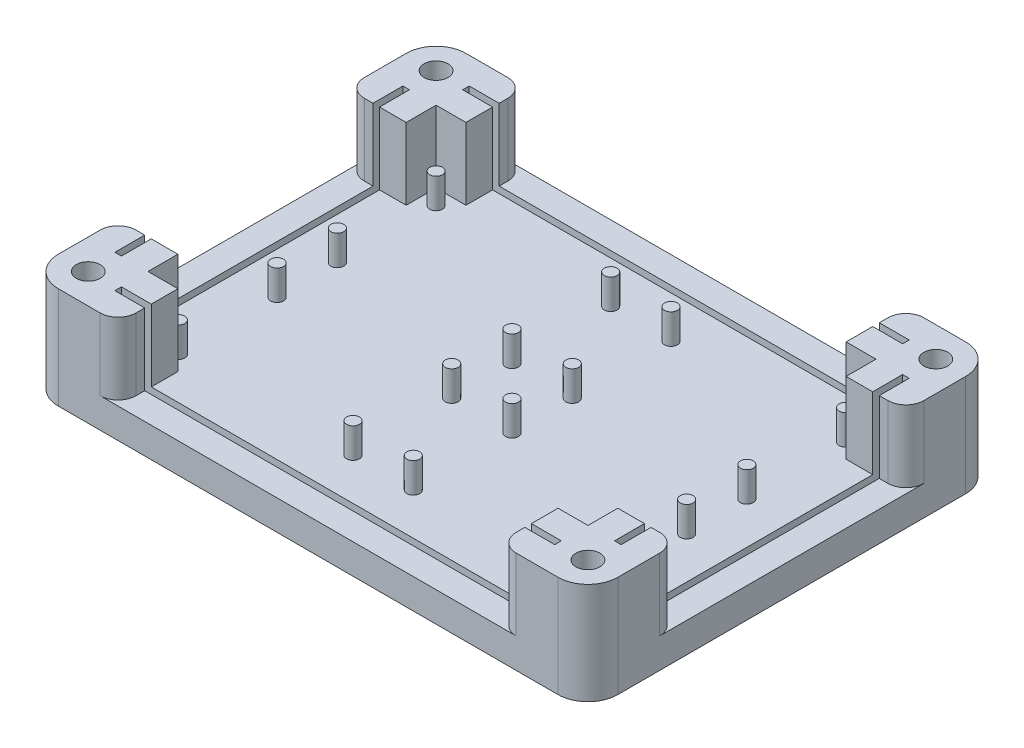
from build123d import *

# Parameters (mm, degrees)
SKETCH1_W                 = 93.58
SKETCH1_H                 = 68.18
BASE_DEPTH                = 5
SKETCH2_W                 = 93.58
SKETCH2_H                 = 68.18
WALLS_DEPTH               = 12
SKETCH2_4_R               = 1.07
SCREW_HOLES_DEPTH         = 5
SKETCH4_W                 = 4.45
SKETCH4_H                 = 38.18
SKETCH4_W_2               = 1.1
SKETCH4_W_3               = 63.58
SKETCH4_H_2               = 4.45
SKETCH4_H_3               = 1.1
WALLS_CUT_DEPTH           = 12
SKETCH4_3_W               = 5
SKETCH4_3_H               = 1.1
SKETCH4_3_W_2             = 1.1
SKETCH4_3_H_2             = 5
SKETCH4_3_W_3             = 63.58
SKETCH4_3_H_3             = 38.18
ACRYLIC_CUT_DEPTH         = 14
FILLET2_R                 = 5
FILLET3_R                 = 3
SKETCH5_W                 = 34
SKETCH5_H                 = 34
ARM_ATTACH_BODY_CUT_DEPTH = 1.5
SKETCH6_R                 = 2
CUT_EXTRUDE1_DEPTH        = 61.335994232


with BuildPart() as part:
    # Sketch1 → Base (new body)
    with BuildSketch(Plane(origin=(0, 0, 0), x_dir=(1, 0, 0), z_dir=(0, 1, 0))):
        Rectangle(SKETCH1_W, SKETCH1_H)
    extrude(amount=BASE_DEPTH)

    # Sketch2 → Walls (add)
    with BuildSketch(Plane(origin=(0, 5, 0), x_dir=(1, 0, 0), z_dir=(0, 1, 0))):
        Rectangle(SKETCH2_W, SKETCH2_H)
        Polygon((36.79, -2), (36.79, -24.09), (2, -24.09), (-2, -24.09), (-36.79, -24.09), (-36.79, -2), (-36.79, 2), (-36.79, 24.09), (-2, 24.09), (2, 24.09), (36.79, 24.09), (36.79, 2), align=None, mode=Mode.SUBTRACT)
    extrude(amount=WALLS_DEPTH)

    # Sketch2<4> → Screw Holes (add)
    with BuildSketch(Plane(origin=(0, 5, 0), x_dir=(1, 0, 0), z_dir=(0, 1, 0))):
        with Locations(Location((-5.04, 5.04, 0), (0, 0, 270))):
            Circle(SKETCH2_4_R)
        with Locations(Location((-34.25, 5.04, 0), (0, 0, 270))):
            Circle(SKETCH2_4_R)
        with Locations(Location((-34.25, 21.55, 0), (0, 0, 270))):
            Circle(SKETCH2_4_R)
        with Locations(Location((5.04, 21.55, 0), (0, 0, 90))):
            Circle(SKETCH2_4_R)
        with Locations(Location((5.04, 5.04, 0), (0, 0, 90))):
            Circle(SKETCH2_4_R)
        with Locations(Location((34.25, 5.04, 0), (0, 0, 90))):
            Circle(SKETCH2_4_R)
        with Locations(Location((34.25, 21.55, 0), (0, 0, 90))):
            Circle(SKETCH2_4_R)
        with Locations(Location((34.25, -5.04, 0), (0, 0, 270))):
            Circle(SKETCH2_4_R)
        with Locations(Location((34.25, -21.55, 0), (0, 0, 270))):
            Circle(SKETCH2_4_R)
        with Locations(Location((5.04, -21.55, 0), (0, 0, 270))):
            Circle(SKETCH2_4_R)
        with Locations(Location((5.04, -5.04, 0), (0, 0, 270))):
            Circle(SKETCH2_4_R)
        with Locations(Location((-5.04, -5.04, 0), (0, 0, 90))):
            Circle(SKETCH2_4_R)
        with Locations(Location((-34.25, -5.04, 0), (0, 0, 90))):
            Circle(SKETCH2_4_R)
        with Locations(Location((-34.25, -21.55, 0), (0, 0, 90))):
            Circle(SKETCH2_4_R)
        with Locations(Location((-5.04, -21.55, 0), (0, 0, 90))):
            Circle(SKETCH2_4_R)
        with Locations(Location((-5.04, 21.55, 0), (0, 0, 90))):
            Circle(SKETCH2_4_R)
    extrude(amount=SCREW_HOLES_DEPTH)

    # Sketch4 → Walls Cut (cut)
    with BuildSketch(Plane(origin=(0, 17, 0), x_dir=(1, 0, 0), z_dir=(0, 1, 0))):
        with Locations((39.015, 0)):
            Rectangle(SKETCH4_W, SKETCH4_H)
        with Locations((44.565, 0)):
            Rectangle(SKETCH4_W, SKETCH4_H)
        with Locations((41.79, 0)):
            Rectangle(SKETCH4_W_2, SKETCH4_H)
        with Locations((0, -26.315)):
            Rectangle(SKETCH4_W_3, SKETCH4_H_2)
        with Locations((0, -31.865)):
            Rectangle(SKETCH4_W_3, SKETCH4_H_2)
        with Locations((0, -29.09)):
            Rectangle(SKETCH4_W_3, SKETCH4_H_3)
        with Locations((0, 26.315)):
            Rectangle(SKETCH4_W_3, SKETCH4_H_2)
        with Locations((0, 29.09)):
            Rectangle(SKETCH4_W_3, SKETCH4_H_3)
        with Locations((0, 31.865)):
            Rectangle(SKETCH4_W_3, SKETCH4_H_2)
        with Locations((-39.015, 0)):
            Rectangle(SKETCH4_W, SKETCH4_H)
        with Locations((-44.565, 0)):
            Rectangle(SKETCH4_W, SKETCH4_H)
        with Locations((-41.79, 0)):
            Rectangle(SKETCH4_W_2, SKETCH4_H)
    extrude(amount=-WALLS_CUT_DEPTH, mode=Mode.SUBTRACT)

    # Sketch4<3> → Acrylic Cut (cut)
    with BuildSketch(Plane(origin=(0, 17, 0), x_dir=(1, 0, 0), z_dir=(0, 1, 0))):
        with Locations((34.29, 29.09)):
            Rectangle(SKETCH4_3_W, SKETCH4_3_H)
        with Locations((-34.29, 29.09)):
            Rectangle(SKETCH4_3_W, SKETCH4_3_H)
        with Locations((-41.79, 21.59)):
            Rectangle(SKETCH4_3_W_2, SKETCH4_3_H_2)
        with Locations((-41.79, -21.59)):
            Rectangle(SKETCH4_3_W_2, SKETCH4_3_H_2)
        with Locations((-34.29, -29.09)):
            Rectangle(SKETCH4_3_W, SKETCH4_3_H)
        with Locations((41.79, -21.59)):
            Rectangle(SKETCH4_3_W_2, SKETCH4_3_H_2)
        with Locations((34.29, -29.09)):
            Rectangle(SKETCH4_3_W, SKETCH4_3_H)
        with Locations((41.79, 21.59)):
            Rectangle(SKETCH4_3_W_2, SKETCH4_3_H_2)
        with Locations((0, -29.09)):
            Rectangle(SKETCH4_3_W_3, SKETCH4_3_H)
        with Locations((-41.79, 0)):
            Rectangle(SKETCH4_3_W_2, SKETCH4_3_H_3)
        with Locations((0, 29.09)):
            Rectangle(SKETCH4_3_W_3, SKETCH4_3_H)
        with Locations((41.79, 0)):
            Rectangle(SKETCH4_3_W_2, SKETCH4_3_H_3)
    extrude(amount=-ACRYLIC_CUT_DEPTH, mode=Mode.SUBTRACT)

    # Fillet2
    fillet2_edges = [part.edges().sort_by_distance(p)[0] for p in [
        (-46.79, 8.5, 34.09),
        (46.79, 8.5, 34.09),
        (46.79, 8.5, -34.09),
        (-46.79, 8.5, -34.09),
    ]]
    fillet(fillet2_edges, radius=FILLET2_R)

    # Fillet3
    fillet3_edges = [part.edges().sort_by_distance(p)[0] for p in [
        (46.79, 11, -19.09),
        (46.79, 11, 19.09),
        (31.79, 11, 34.09),
        (-31.79, 11, 34.09),
        (-31.79, 11, -34.09),
        (31.79, 11, -34.09),
        (-46.79, 11, 19.09),
        (-46.79, 11, -19.09),
    ]]
    fillet(fillet3_edges, radius=FILLET3_R)

    # Sketch5 → Arm Attach Body Cut (cut)
    with BuildSketch(Plane.XZ):
        Rectangle(SKETCH5_W, SKETCH5_H)
    extrude(amount=-ARM_ATTACH_BODY_CUT_DEPTH, mode=Mode.SUBTRACT)

    # Sketch6 → Cut-Extrude1 (cut, through all)
    with BuildSketch(Plane(origin=(0, 17, 0), x_dir=(1, 0, 0), z_dir=(0, 1, 0))):
        with Locations(Location((-41.79, 29.09, 0), (0, 0, 270))):
            Circle(SKETCH6_R)
        with Locations(Location((41.79, 29.09, 0), (0, 0, 90))):
            Circle(SKETCH6_R)
        with Locations(Location((41.79, -29.09, 0), (0, 0, 270))):
            Circle(SKETCH6_R)
        with Locations(Location((-41.79, -29.09, 0), (0, 0, 90))):
            Circle(SKETCH6_R)
    extrude(amount=-CUT_EXTRUDE1_DEPTH, mode=Mode.SUBTRACT)


solid = part.part
